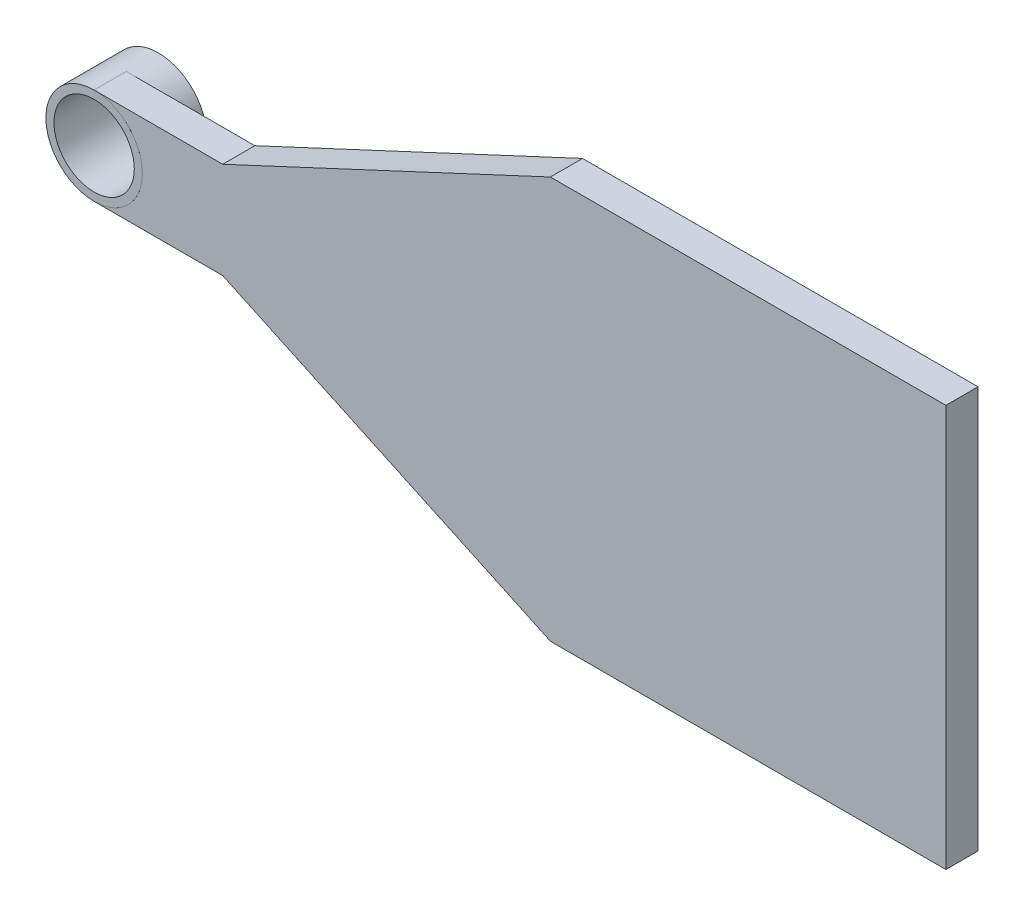
from build123d import *

# Parameters (mm, degrees)
SKETCH2_R                       = 6
SKETCH2_R_2                     = 5
BOSS_EXTRUDE1_DEPTH             = 8
SKETCH3_W                       = 4
SKETCH3_H                       = 12
BOSS_EXTRUDE2_DEPTH             = 10
BOSS_EXTRUDE2_DIRECTION_2_REACH = 17.62
BOSS_EXTRUDE3_DEPTH             = 4


with BuildPart() as part:
    # Sketch2 → Boss-Extrude1 (new body)
    with BuildSketch(Plane.XY):
        Circle(SKETCH2_R)
        Circle(SKETCH2_R_2, mode=Mode.SUBTRACT)
    extrude(amount=BOSS_EXTRUDE1_DEPTH)


with BuildPart() as body_2:
    # Sketch3 → Boss-Extrude2 (new body)
    with BuildSketch(Plane(origin=(6, 0, 0), x_dir=(0, 0, -1), z_dir=(1, 0, 0))):
        with Locations((-6, 0)):
            Rectangle(SKETCH3_W, SKETCH3_H)
    extrude(amount=BOSS_EXTRUDE2_DEPTH)


    # Sketch3 → Boss-Extrude2 direction 2 (add, up to next)
    with BuildSketch(Plane(origin=(6, 0, 0), x_dir=(0, 0, -1), z_dir=(1, 0, 0)), mode=Mode.PRIVATE) as boss_extrude2_direction_2_sk1:
        with Locations((-6, 0)):
            Rectangle(SKETCH3_W, SKETCH3_H)
    boss_extrude2_direction_2_tool1 = extrude(boss_extrude2_direction_2_sk1.sketch, amount=-BOSS_EXTRUDE2_DIRECTION_2_REACH, mode=Mode.PRIVATE) - part.part
    add(boss_extrude2_direction_2_tool1.solids().sort_by_distance((6, 0, 6))[0])
    add(boss_extrude2_direction_2_tool1.solids().sort_by_distance((6, 0, 6))[1])

    # Sketch4 → Boss-Extrude3 (add)
    with BuildSketch(Plane(origin=(0, 0, 4), x_dir=(-1, 0, 0), z_dir=(0, 0, -1))):
        Polygon((-16, 6), (-56.783850417, 25.017821778), (-106, 25.017821778), (-106, -25.017821778), (-56.783850417, -25.017821778), (-16, -6), align=None)
    extrude(amount=-BOSS_EXTRUDE3_DEPTH)


solid = Compound([part.part, body_2.part])
